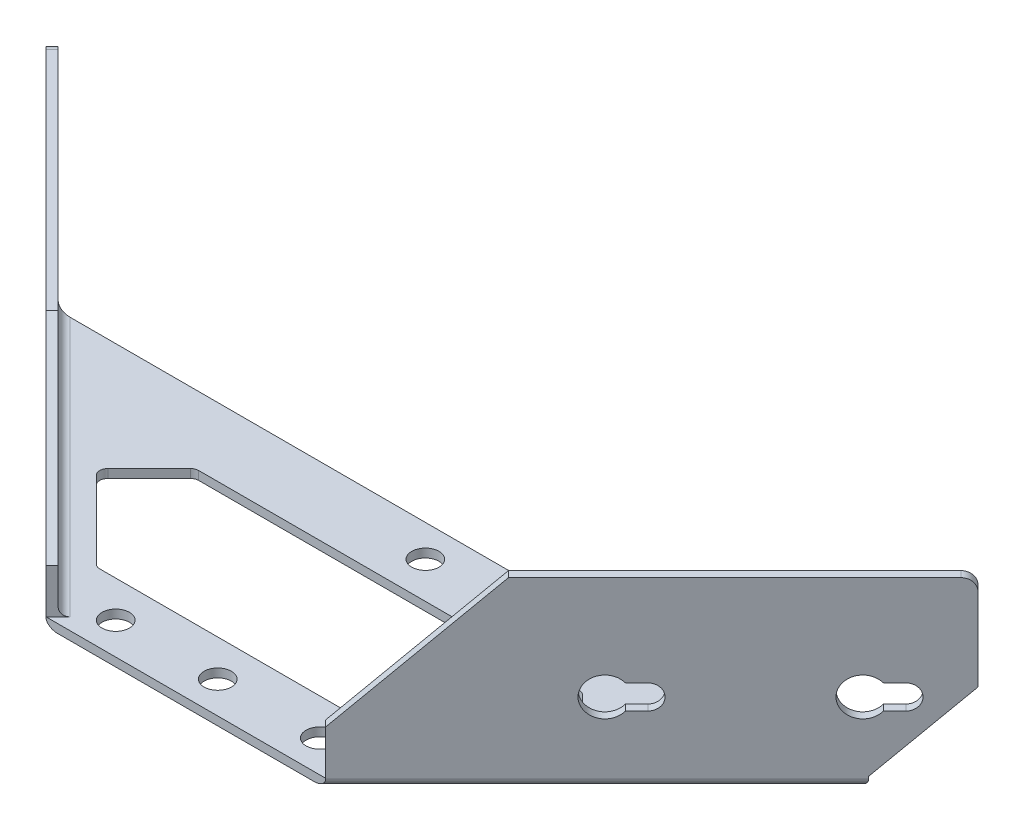
from build123d import *

# Parameters (mm, degrees)
SKETCH1_R                   = 2.25
BASEBOSS_EXTRUDE1_DEPTH     = 1.42
WINGBOSS_EXTRUDE2_DEPTH     = 28.58
FRONTCHAMFER1_SIZE          = 21.26
BACKCHAMFER3_SIZE           = 13
BACKCORNERFILLET1_R         = 2
RIGHTWINGCUT_EXTRUDE1_DEPTH = 117.224315421
LEFTWINGCUT_EXTRUDE2_DEPTH  = 114.155281671
OUTSIDEWINGFILLET2_R        = 1.35
INSIDEWINGFILLET3_R         = 1.35
INSIDECUTOUTFILLET4_R       = 1.35


with BuildPart() as part:
    # Sketch1 → BaseBoss-Extrude1 (new body)
    with BuildSketch(Plane(origin=(0, 0, 0), x_dir=(1, 0, 0), z_dir=(0, 1, 0))):
        Polygon((0, 0), (46, 0), (90.65, 44.65), (-44.65, 44.65), align=None)
        with Locations(Location((23, 39.4, 0), (0, 0, 90))):
            Circle(SKETCH1_R, mode=Mode.SUBTRACT)
        with Locations(Location((23, 5.25, 0), (0, 0, 90))):
            Circle(SKETCH1_R, mode=Mode.SUBTRACT)
        with Locations(Location((39.780728009, 5.25, 0), (0, 0, 90))):
            Circle(SKETCH1_R, mode=Mode.SUBTRACT)
        with Locations(Location((6.219271991, 5.25, 0), (0, 0, 90))):
            Circle(SKETCH1_R, mode=Mode.SUBTRACT)
        Polygon((-16.980980541, 25.268272016), (-2.962708524, 11.25), (48.962708524, 11.25), (62.980980541, 25.268272016), (54.849252557, 33.4), (-8.849252557, 33.4), align=None, mode=Mode.SUBTRACT)
    extrude(amount=BASEBOSS_EXTRUDE1_DEPTH)

    # Sketch2 → WingBoss-Extrude2 (add)
    with BuildSketch(Plane(origin=(0, 1.42, 0), x_dir=(1, 0, 0), z_dir=(0, 1, 0))):
        Polygon((-52.641816741, 54.65), (1.004091629, 1.004091629), (0, 0), (-53.645908371, 53.645908371), align=None)
        Polygon((44.995908371, 1.004091629), (46, 0), (99.645908371, 53.645908371), (98.641816741, 54.65), align=None)
    extrude(amount=WINGBOSS_EXTRUDE2_DEPTH)

    # FrontChamfer1
    frontchamfer1_edges = [part.edges().sort_by_distance(p)[0] for p in [
        (45.497954185, 30, -0.502045815),
        (0.502045815, 30, -0.502045815),
    ]]
    chamfer(frontchamfer1_edges, length=FRONTCHAMFER1_SIZE)

    # BackChamfer3
    backchamfer3_edges = [part.edges().sort_by_distance(p)[0] for p in [
        (-53.143862556, 1.42, -54.147954185),
        (99.143862556, 1.42, -54.147954185),
    ]]
    chamfer(backchamfer3_edges, length=BACKCHAMFER3_SIZE)

    # BackCornerFillet1
    backcornerfillet1_edges = [part.edges().sort_by_distance(p)[0] for p in [
        (99.143862556, 30, -54.147954185),
        (-53.143862556, 30, -54.147954185),
    ]]
    fillet(backcornerfillet1_edges, radius=BACKCORNERFILLET1_R)

    # Sketch3 → RightWingCut-Extrude1 (cut, through all)
    with BuildSketch(Plane(origin=(1.004091629, 0, -1.004091629), x_dir=(-0.7071067811865479, 0, -0.7071067811865471), z_dir=(0.7071067811865471, 0, -0.7071067811865479))):
        with BuildLine():
            Line((64.870634402, 15.004344422), (67.473088065, 15.004351159))
            ThreePointArc((67.473088065, 15.004351159), (69.47743754, 13.002598346), (67.478284754, 10.995655578))
            Line((67.478284754, 10.995655578), (64.870634402, 10.995655578))
            ThreePointArc((64.870634402, 10.995655578), (59.348088065, 13), (64.870634402, 15.004344422))
        make_face()
        with BuildLine():
            Line((34.870634402, 15.004344422), (37.473088065, 15))
            ThreePointArc((37.473088065, 15), (39.473088065, 13), (37.473088065, 11))
            Line((37.473088065, 11), (34.870634402, 10.995655578))
            ThreePointArc((34.870634402, 10.995655578), (29.348088065, 13), (34.870634402, 15.004344422))
        make_face()
    extrude(amount=-RIGHTWINGCUT_EXTRUDE1_DEPTH, mode=Mode.SUBTRACT)

    # Sketch4 → LeftWingCut-Extrude2 (cut, through all)
    with BuildSketch(Plane(origin=(21.995908371, 0, 21.995908371), x_dir=(-0.7071067811865476, 0, 0.7071067811865476), z_dir=(-0.7071067811865476, 0, -0.7071067811865476))):
        with BuildLine():
            Line((-97.397545502, 10.995654579), (-100.005197879, 10.995654579))
            ThreePointArc((-100.005197879, 10.995654579), (-102.004350476, 13.002598942), (-100, 15.004352161))
            Line((-100, 15.004352161), (-97.397545502, 15.004345421))
            ThreePointArc((-97.397545502, 15.004345421), (-91.875, 13), (-97.397545502, 10.995654579))
        make_face()
        with BuildLine():
            Line((-67.397545502, 10.995654579), (-70, 11))
            ThreePointArc((-70, 11), (-72, 13), (-70, 15))
            Line((-70, 15), (-67.397545502, 15.004345421))
            ThreePointArc((-67.397545502, 15.004345421), (-61.875, 13), (-67.397545502, 10.995654579))
        make_face()
    extrude(amount=-LEFTWINGCUT_EXTRUDE2_DEPTH, mode=Mode.SUBTRACT)

    # outsideWingFillet2
    outsidewingfillet2_edges = [part.edges().sort_by_distance(p)[0] for p in [
        (68.325, 0, -22.325),
        (-22.325, 0, -22.325),
    ]]
    fillet(outsidewingfillet2_edges, radius=OUTSIDEWINGFILLET2_R)

    # InsideWingFillet3
    insidewingfillet3_edges = [part.edges().sort_by_distance(p)[0] for p in [
        (66.818862556, 1.42, -22.827045815),
        (-20.818862556, 1.42, -22.827045815),
    ]]
    fillet(insidewingfillet3_edges, radius=INSIDEWINGFILLET3_R)

    # InsideCutoutFillet4
    insidecutoutfillet4_edges = [part.edges().sort_by_distance(p)[0] for p in [
        (48.962708524, 0.71, -11.25),
        (62.980980541, 0.71, -25.268272016),
        (54.849252557, 0.71, -33.4),
        (-8.849252557, 0.71, -33.4),
        (-16.980980541, 0.71, -25.268272016),
        (-2.962708524, 0.71, -11.25),
    ]]
    fillet(insidecutoutfillet4_edges, radius=INSIDECUTOUTFILLET4_R)


solid = part.part
